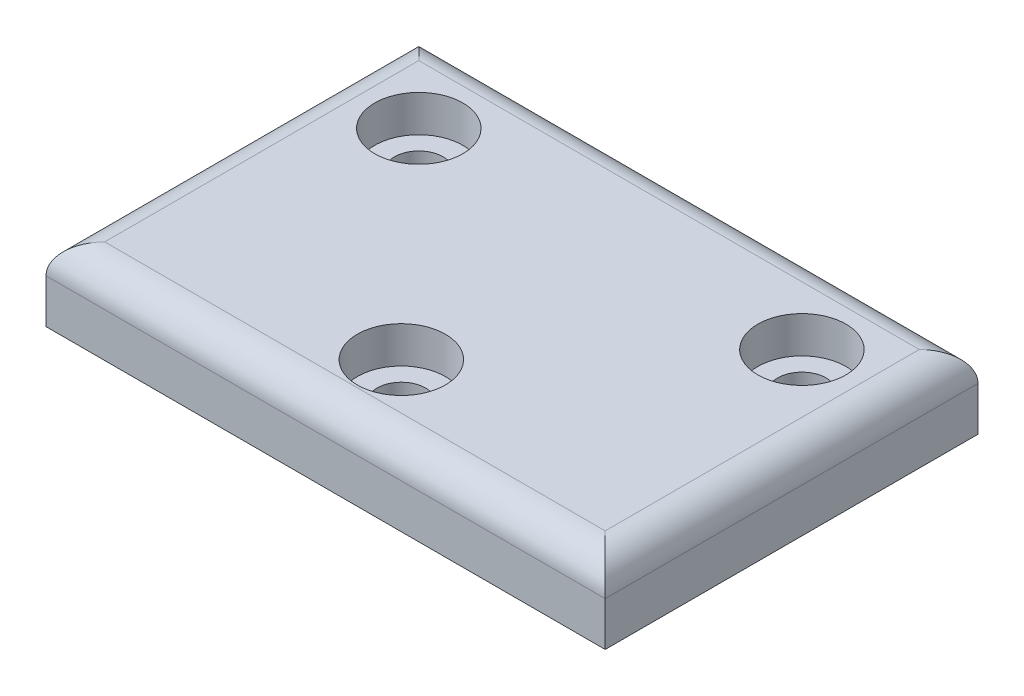
from build123d import *

# Parameters (mm, degrees)
SKETCH1_W           = 38.1
SKETCH1_H           = 25.4
SKETCH1_R           = 1.65
BOSS_EXTRUDE1_DEPTH = 5
SKETCH2_R           = 3
CUT_EXTRUDE1_DEPTH  = 2.5
FILLET1_R           = 2


with BuildPart() as part:
    # Sketch1 → Boss-Extrude1 (new body)
    with BuildSketch(Plane(origin=(0, 0, 0), x_dir=(1, 0, 0), z_dir=(0, 1, 0))):
        with Locations((19.05, 12.7)):
            Rectangle(SKETCH1_W, SKETCH1_H)
        with Locations(Location((19.05, 5.16, 0), (0, 0, 270))):
            Circle(SKETCH1_R, mode=Mode.SUBTRACT)
        with Locations(Location((6, 19.4, 0), (0, 0, 270))):
            Circle(SKETCH1_R, mode=Mode.SUBTRACT)
        with Locations(Location((32.1, 19.4, 0), (0, 0, 90))):
            Circle(SKETCH1_R, mode=Mode.SUBTRACT)
    extrude(amount=BOSS_EXTRUDE1_DEPTH)

    # Sketch2 → Cut-Extrude1 (cut)
    with BuildSketch(Plane(origin=(0, 5, 0), x_dir=(1, 0, 0), z_dir=(0, 1, 0))):
        with Locations(Location((6, 19.4, 0), (0, 0, 270))):
            Circle(SKETCH2_R)
        with Locations(Location((19.05, 5.16, 0), (0, 0, 270))):
            Circle(SKETCH2_R)
        with Locations(Location((32.1, 19.4, 0), (0, 0, 270))):
            Circle(SKETCH2_R)
    extrude(amount=-CUT_EXTRUDE1_DEPTH, mode=Mode.SUBTRACT)

    # Fillet1
    fillet1_edges = [part.edges().sort_by_distance(p)[0] for p in [
        (38.1, 5, -12.7),
        (19.05, 5, -25.4),
        (0, 5, -12.7),
        (19.05, 5, 0),
    ]]
    fillet(fillet1_edges, radius=FILLET1_R)


solid = part.part
